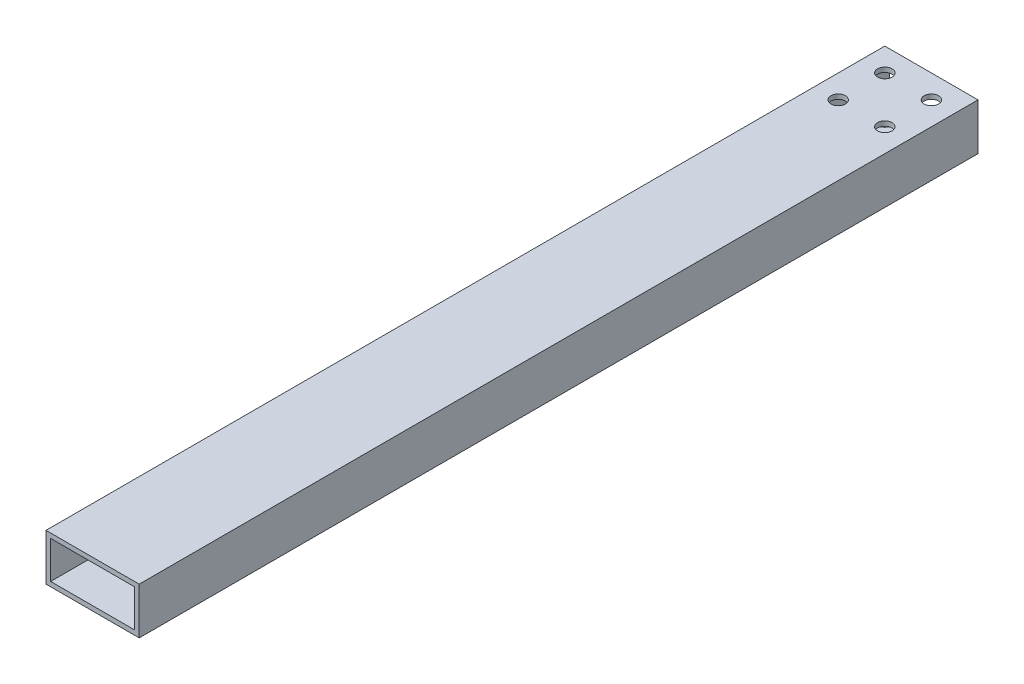
from build123d import *

# Parameters (mm, degrees)
SKETCH_1_W          = 20
SKETCH_1_H          = 10
SKETCH_1_W_2        = 18
SKETCH_1_H_2        = 8
EXTRUDE_1_DEPTH     = 180
SKETCH_2_R          = 1.55
CUT_EXTRUDE_1_DEPTH = 182.383571472


with BuildPart() as part:
    # 草图1 → 凸台-拉伸1 (new body)
    with BuildSketch(Plane.XY):
        with Locations((10, 5)):
            Rectangle(SKETCH_1_W, SKETCH_1_H)
        with Locations((10, 5)):
            Rectangle(SKETCH_1_W_2, SKETCH_1_H_2, mode=Mode.SUBTRACT)
    extrude(amount=EXTRUDE_1_DEPTH)

    # 草图2 → 切除-拉伸1 (cut, through all)
    with BuildSketch(Plane.XZ):
        with Locations(Location((5, 5, 0), (0, 0, 270))):
            Circle(SKETCH_2_R)
        with Locations(Location((15, 5, 0), (0, 0, 270))):
            Circle(SKETCH_2_R)
        with Locations(Location((15, 15, 0), (0, 0, 270))):
            Circle(SKETCH_2_R)
        with Locations(Location((5, 15, 0), (0, 0, 270))):
            Circle(SKETCH_2_R)
    extrude(amount=-CUT_EXTRUDE_1_DEPTH, mode=Mode.SUBTRACT)


solid = part.part
